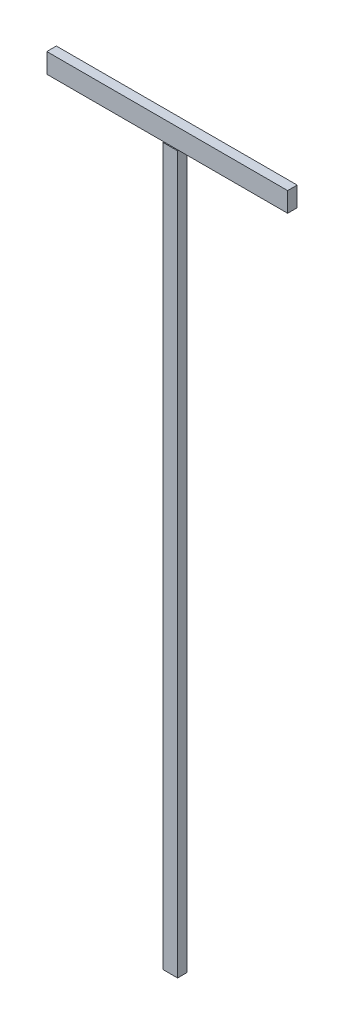
from build123d import *

# Parameters (mm, degrees)
SKETCH_1_W        = 252.036479427
SKETCH_1_H        = 20.59010667
EXTRUDE_1_DEPTH   = 10
SKETCH_1_W_2      = 15.347561206
SKETCH_1_H_2      = 749.541552464
EXTRUDE_1_2_DEPTH = 10


with BuildPart() as part:
    # Эскиз1 → Бобышка-Вытянуть1 (new body)
    with BuildSketch(Plane.XY):
        with Locations((56.275273207, 36.78697033)):
            Rectangle(SKETCH_1_W, SKETCH_1_H)
    extrude(amount=EXTRUDE_1_DEPTH)


with BuildPart() as body_2:
    # Эскиз1 → Extrude 1 2 (new body)
    with BuildSketch(Plane.XY):
        with Locations((59.459223612, -349.265925692)):
            Rectangle(SKETCH_1_W_2, SKETCH_1_H_2)
    extrude(amount=EXTRUDE_1_2_DEPTH)


solid = Compound([part.part, body_2.part])
